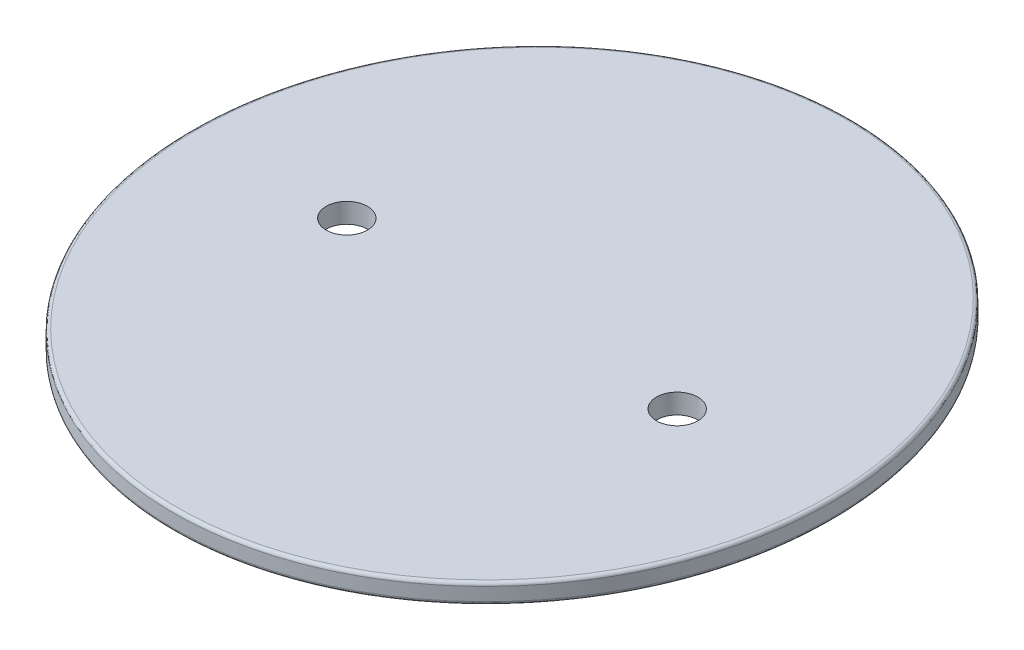
from build123d import *

# Parameters (mm, degrees)
SKETCH1_RX          = 102.5
SKETCH1_RY          = 96.9
SKETCH1_R           = 6.25
BOSS_EXTRUDE1_DEPTH = 3
FILLET1_R           = 1


with BuildPart() as part:
    # Sketch1 → Boss-Extrude1 (new, symmetric)
    with BuildSketch(Plane(origin=(0, 0, 0), x_dir=(1, 0, 0), z_dir=(0, 1, 0))):
        with Locations(Location((0, 0), (0, 0, 90))):
            Ellipse(SKETCH1_RX, SKETCH1_RY)
        with Locations(Location((-50, 0, 0), (0, 0, 270))):
            Circle(SKETCH1_R, mode=Mode.SUBTRACT)
        with Locations(Location((50, 0, 0), (0, 0, 270))):
            Circle(SKETCH1_R, mode=Mode.SUBTRACT)
    extrude(amount=BOSS_EXTRUDE1_DEPTH, both=True)

    # Fillet1
    fillet1_edges = [part.edges().sort_by_distance(p)[0] for p in [
        (0.000247524, -3, 102.5),
        (0.000247524, 3, 102.5),
    ]]
    fillet(fillet1_edges, radius=FILLET1_R)


solid = part.part
